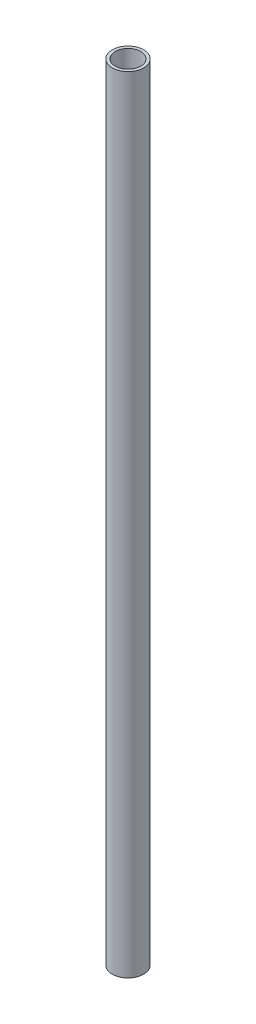
from build123d import *

# Parameters (mm, degrees)
SKETCH1_R           = 8
SKETCH1_R_2         = 6.5
BOSS_EXTRUDE1_DEPTH = 400


with BuildPart() as part:
    # Sketch1 → Boss-Extrude1 (new body)
    with BuildSketch(Plane(origin=(0, 0, 0), x_dir=(1, 0, 0), z_dir=(0, 1, 0))):
        with Locations(Location((0, 0, 0), (0, 0, 270))):
            Circle(SKETCH1_R)
        with Locations(Location((0, 0, 0), (0, 0, 270))):
            Circle(SKETCH1_R_2, mode=Mode.SUBTRACT)
    extrude(amount=BOSS_EXTRUDE1_DEPTH)


solid = part.part
